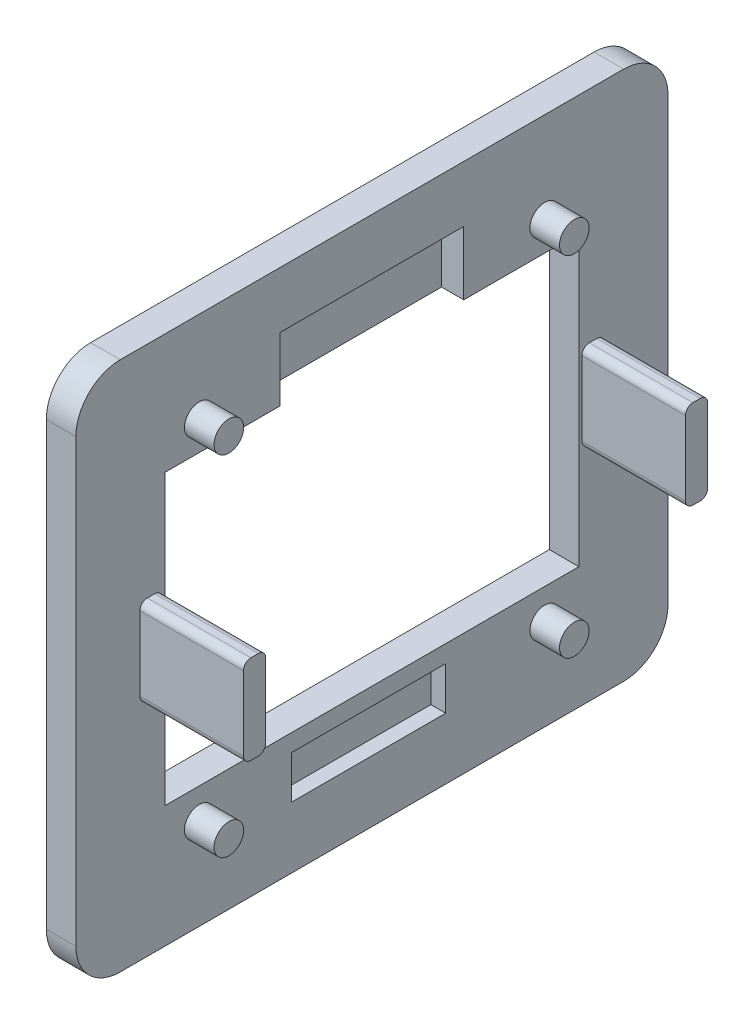
from build123d import *

# Parameters (mm, degrees)
ESQUISSE3_W             = 40
ESQUISSE3_H             = 35.82
BOSS_EXTRU_1_DEPTH      = 2
ESQUISSE4_R             = 1
BOSS_EXTRU_2_DEPTH      = 2
ESQUISSE5_W             = 10.4
ESQUISSE5_H             = 2.9
ENL_V_MAT_EXTRU_1_DEPTH = 1
ESQUISSE6_W             = 12.4
ESQUISSE6_H             = 4.5
ENL_V_MAT_EXTRU_2_DEPTH = 1.5
ESQUISSE8_W             = 1.5
ESQUISSE8_H             = 6
BOSS_EXTRU_3_DEPTH      = 7
CONG_1_R                = 0.5
CONG_1_OF_SYM_TRIE1_R   = 0.5
CONG_2_R                = 3


with BuildPart() as part:
    # Esquisse3 → Boss.-Extru.1 (new body)
    with BuildSketch(Plane.ZY.offset(2.820074362)):
        Rectangle(ESQUISSE3_W, ESQUISSE3_H)
        Polygon((-13.98, 9.81), (-13.98, -9.69), (13.98, -9.69), (13.98, 9.81), (6, 9.81), (-6, 9.81), align=None, mode=Mode.SUBTRACT)
    extrude(amount=BOSS_EXTRU_1_DEPTH)

    # Esquisse4 → Boss.-Extru.2 (add)
    with BuildSketch(Plane(origin=(-2.820074362, 0, 0), x_dir=(0, 0, -1), z_dir=(1, 0, 0))):
        with Locations(Location((-11.668662175, 11.778743894, 0), (0, 0, 180))):
            Circle(ESQUISSE4_R)
        with Locations(Location((-11.668662175, -11.778743894, 0), (0, 0, 180))):
            Circle(ESQUISSE4_R)
        with Locations(Location((11.668662175, -11.778743894, 0), (0, 0, 180))):
            Circle(ESQUISSE4_R)
        with Locations(Location((11.668662175, 11.778743894, 0), (0, 0, 180))):
            Circle(ESQUISSE4_R)
    extrude(amount=BOSS_EXTRU_2_DEPTH)

    # Esquisse5 → Enlèv. mat.-Extru.1 (cut)
    with BuildSketch(Plane(origin=(-2.820074362, 0, 0), x_dir=(0, 0, -1), z_dir=(1, 0, 0))):
        with Locations((-0.22, -12.31)):
            Rectangle(ESQUISSE5_W, ESQUISSE5_H)
    extrude(amount=-ENL_V_MAT_EXTRU_1_DEPTH, mode=Mode.SUBTRACT)

    # Esquisse6 → Enlèv. mat.-Extru.2 (cut)
    with BuildSketch(Plane(origin=(-2.820074362, 0, 0), x_dir=(0, 0, -1), z_dir=(1, 0, 0))):
        with Locations((0, 11.86)):
            Rectangle(ESQUISSE6_W, ESQUISSE6_H)
    extrude(amount=-ENL_V_MAT_EXTRU_2_DEPTH, mode=Mode.SUBTRACT)

    # Esquisse8 → Boss.-Extru.3 (add)
    with BuildSketch(Plane(origin=(-2.820074362, 0, 0), x_dir=(0, 0, -1), z_dir=(1, 0, 0))):
        with Locations((-14.93, 0.06)):
            Rectangle(ESQUISSE8_W, ESQUISSE8_H)
    boss_extru_3 = extrude(amount=BOSS_EXTRU_3_DEPTH)

    # Congé1
    cong_1_edges = [part.edges().sort_by_distance(p)[0] for p in [
        (0.679925638, 3.06, 15.68),
        (0.679925638, -2.94, 15.68),
        (0.679925638, -2.94, 14.18),
        (0.679925638, 3.06, 14.18),
    ]]
    fillet(cong_1_edges, radius=CONG_1_R)

    # Symétrie1: Boss.-Extru.3 across plane
    add(boss_extru_3.mirror(Plane.XY))

    # Congé1 of Symétrie1
    cong_1_of_sym_trie1_edges = [part.edges().sort_by_distance(p)[0] for p in [
        (0.679925638, 3.06, -15.68),
        (0.679925638, -2.94, -15.68),
        (0.679925638, -2.94, -14.18),
        (0.679925638, 3.06, -14.18),
    ]]
    fillet(cong_1_of_sym_trie1_edges, radius=CONG_1_OF_SYM_TRIE1_R)

    # Congé2
    cong_2_edges = [part.edges().sort_by_distance(p)[0] for p in [
        (-3.820074362, 17.91, -20),
        (-3.820074362, 17.91, 20),
        (-3.820074362, -17.91, 20),
        (-3.820074362, -17.91, -20),
    ]]
    fillet(cong_2_edges, radius=CONG_2_R)


solid = part.part
